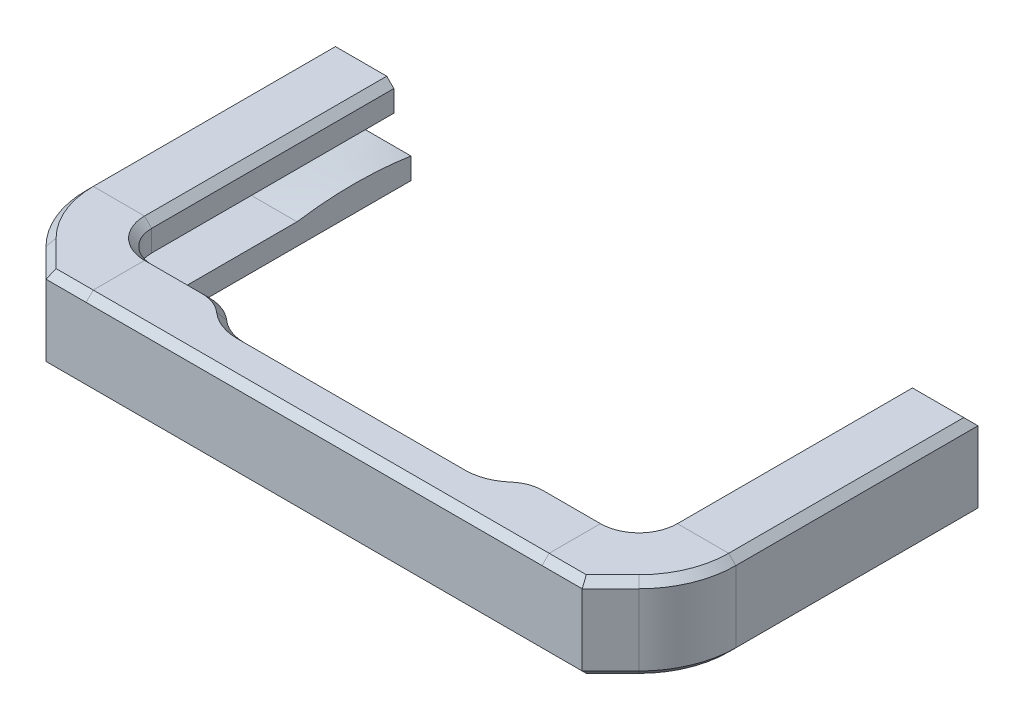
from build123d import *

# Parameters (mm, degrees)
BOSS_EXTRUDE1_DEPTH = 6
CUT_EXTRUDE1_REACH  = 33.573
CHAMFER2_SIZE       = 0.5


with BuildPart() as part:
    # Sweep3: sweep along a path in Sketch1
    with BuildLine(Plane(origin=(0, 0, 0), x_dir=(1, 0, 0), z_dir=(0, 1, 0))) as sweep3_path:
        Line((-20, 21), (-20, 4))
        ThreePointArc((-20, 4), (-18.828427125, 1.171572875), (-16, 0))
        Line((-16, 0), (16, 0))
        ThreePointArc((16, 0), (18.828427125, 1.171572875), (20, 4))
        Line((20, 4), (20, 21))
    # Sketch2 → Sweep3 (sweep)
    with BuildSketch(Plane.XY.offset(-21)):
        Polygon((18.2, 1), (18.2, 3), (22.8, 3), (22.8, -3), (17, -3), (17, -1), (20.8, -1), (20.8, 1), align=None)
    sweep(path=sweep3_path.line)

    # Sketch5 → Boss-Extrude1 (add, through all)
    with BuildSketch(Plane.XZ.offset(3)):
        Polygon((-16, 2.8), (-18.816652224, 2.8), (-20.808326112, 0.808326112), align=None)
    boss_extrude1 = extrude(amount=-BOSS_EXTRUDE1_DEPTH)

    # Mirror2: Boss-Extrude1 across plane
    add(boss_extrude1.mirror(Plane(origin=(0, 0, 0), x_dir=(0, 0, 1), z_dir=(1, 0, 0))))

    # Sketch6 → Cut-Extrude1 (cut, up to next)
    with BuildSketch(Plane(origin=(0, 3, 0), x_dir=(1, 0, 0), z_dir=(0, 1, 0)), mode=Mode.PRIVATE) as cut_extrude1_sk1:
        with BuildLine():
            Line((-8, 0.3), (8, 0.3))
            ThreePointArc((8, 0.3), (9.060660172, 0.49375696), (9.984313483, 1.05))
            ThreePointArc((9.984313483, 1.05), (10.907966795, 1.60624304), (11.968626967, 1.8))
            Line((11.968626967, 1.8), (-11.968626967, 1.8))
            ThreePointArc((-11.968626967, 1.8), (-10.907966795, 1.60624304), (-9.984313483, 1.05))
            ThreePointArc((-9.984313483, 1.05), (-9.060660172, 0.49375696), (-8, 0.3))
        make_face()
    cut_extrude1_tool1 = extrude(cut_extrude1_sk1.sketch, amount=-CUT_EXTRUDE1_REACH, mode=Mode.PRIVATE) & part.part
    add(cut_extrude1_tool1.solids().sort_by_distance((0, 3, -1.083194))[0], mode=Mode.SUBTRACT)

    # Chamfer2
    chamfer2_edges = [part.edges().sort_by_distance(p)[0] for p in [
        (13.984313483, 3, -1.8),
        (-10.907966795, 3, -1.60624304),
        (-9.060660172, 3, -0.49375696),
        (0, 3, -0.3),
        (9.060660172, 3, -0.49375696),
        (10.907966795, 3, -1.60624304),
        (0, -3, -3),
        (0, -3, 2.8),
        (0, 3, 2.8),
        (-13.984313483, 3, -1.8),
        (16.707106781, -3, -3.292893219),
        (17.555634919, 3, -2.444365081),
        (17, -3, -12.5),
        (19.9, -3, -21),
        (22.8, -3, -12.5),
        (22.8, 3, -12.5),
        (20.5, 3, -21),
        (18.2, 3, -12.5),
        (-17, -3, -12.5),
        (-22.8, -3, -12.5),
        (-22.8, 3, -12.5),
        (-18.2, 3, -12.5),
        (-16.707106781, -3, -3.292893219),
        (-22.282380821, -3, -1.39775266),
        (-19.812489168, 3, 1.804163056),
        (0, 3, 2.8),
        (0, -3, 2.8),
        (-19.812489168, -3, 1.804163056),
        (-22.282380821, 3, -1.39775266),
        (-17.555634919, 3, -2.444365081),
        (22.282380821, 3, -1.39775266),
        (22.282380821, -3, -1.39775266),
        (0, -3, 2.8),
        (19.812489168, -3, 1.804163056),
        (19.812489168, 3, 1.804163056),
        (0, 3, 2.8),
    ]]
    chamfer(chamfer2_edges, length=CHAMFER2_SIZE)

    # Sketch4 for Loft1 → Loft1 section 0
    with BuildSketch(Plane.ZY.offset(-20.8)):
        with BuildLine():
            Line((-21, -1), (-13, -1))
            # circular arc as an exact rational Bezier (weights 1, cos(half-angle), 1)
            Bezier((-13, -1), (-17, -0.899984373), (-21, -1), weights=[1, 0.999687549, 1])
        make_face()
    # Sketch3 for Loft1 → Loft1 section 1
    with BuildSketch(Plane.ZY.offset(-17)):
        with BuildLine():
            Line((-21, -1), (-13, -1))
            Bezier((-13, -1), (-17, -0.396605908), (-21, -1), weights=[1, 0.988812927, 1])
        make_face()
    loft1 = loft()

    # Mirror1: Loft1 across plane
    add(loft1.mirror(Plane(origin=(0, 0, 0), x_dir=(0, 0, 1), z_dir=(1, 0, 0))))


solid = part.part
